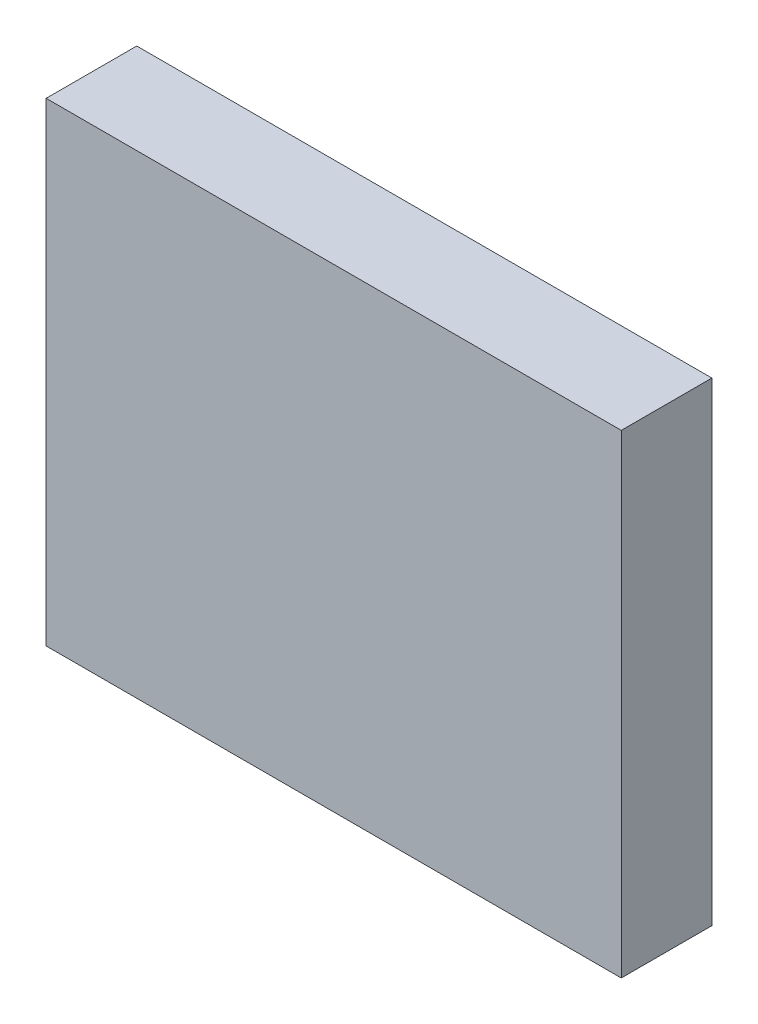
from build123d import *

# Parameters (mm, degrees)
SKETCH4_W           = 15.764080658
SKETCH4_H           = 2.483382569
BOSS_EXTRUDE1_DEPTH = 13


with BuildPart() as part:
    # Sketch4 → Boss-Extrude1 (new body)
    with BuildSketch(Plane(origin=(0, 0, 0), x_dir=(1, 0, 0), z_dir=(0, 1, 0))):
        with Locations((-7.882040329, 1.241691285)):
            Rectangle(SKETCH4_W, SKETCH4_H)
    extrude(amount=BOSS_EXTRUDE1_DEPTH)


solid = part.part
